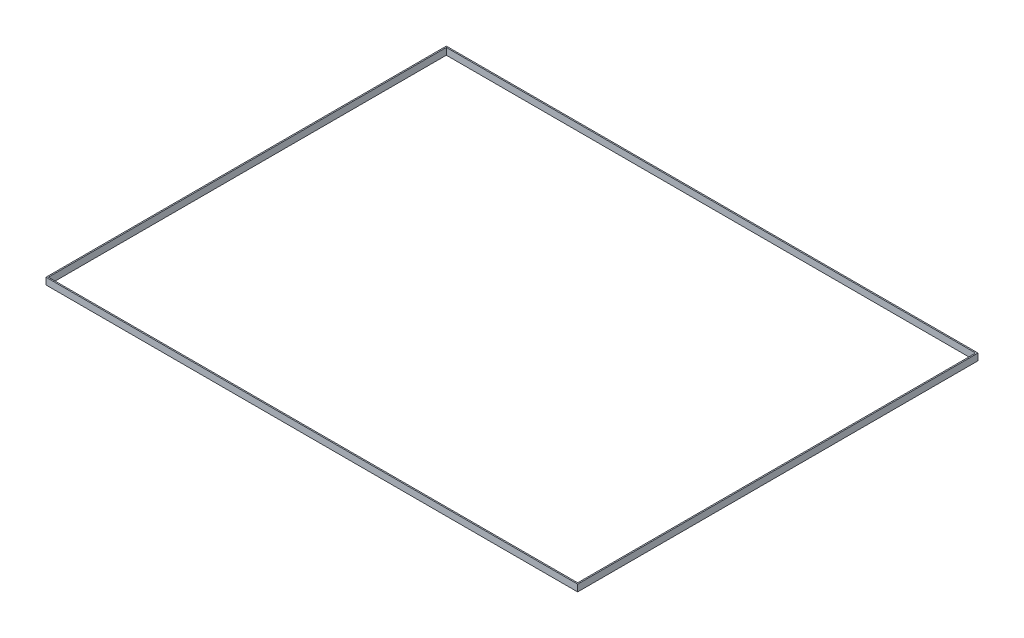
from build123d import *

# Parameters (mm, degrees)
SKETCH1_W           = 13360
SKETCH1_H           = 10060
SKETCH1_W_2         = 13300
SKETCH1_H_2         = 10000
BOSS_EXTRUDE1_DEPTH = 170


with BuildPart() as part:
    # Sketch1 → Boss-Extrude1 (new body)
    with BuildSketch(Plane(origin=(0, 0, 0), x_dir=(1, 0, 0), z_dir=(0, 1, 0))):
        Rectangle(SKETCH1_W, SKETCH1_H)
        Rectangle(SKETCH1_W_2, SKETCH1_H_2, mode=Mode.SUBTRACT)
    extrude(amount=BOSS_EXTRUDE1_DEPTH)


solid = part.part
